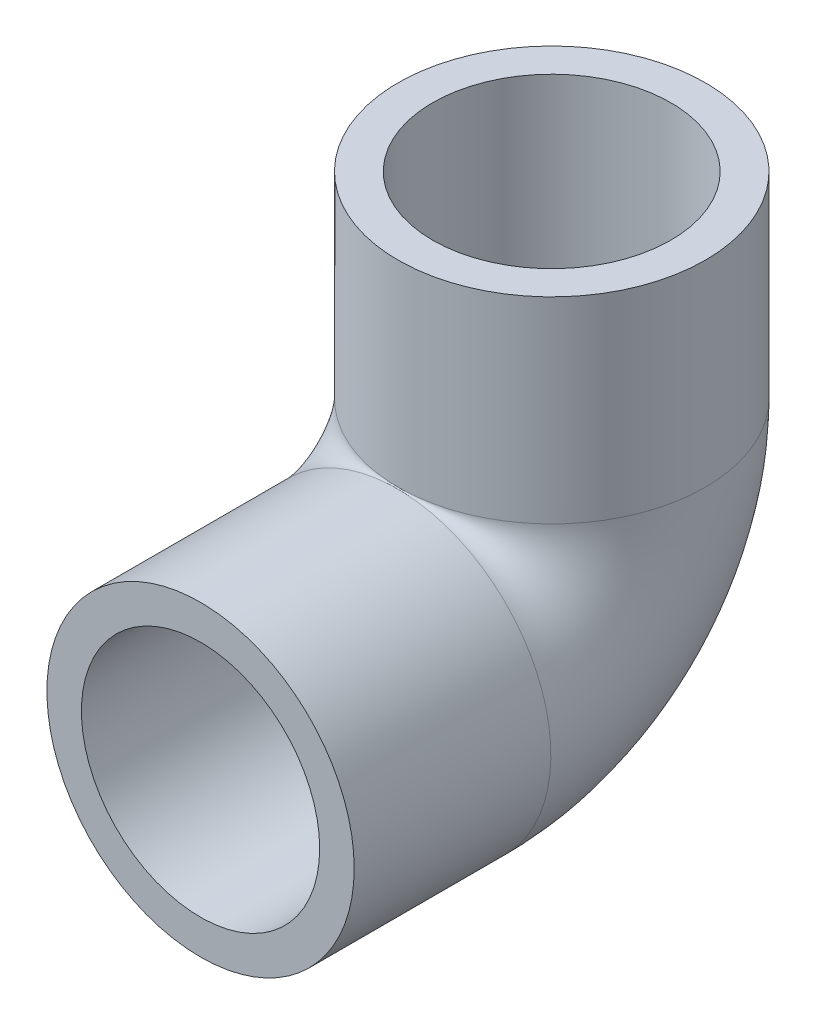
from build123d import *

# Parameters (mm, degrees)
SKETCH1_R          = 13.890625
SKETCH1_R_2        = 8.89
SKETCH3_R          = 10.7696
CUT_EXTRUDE1_DEPTH = 19.05
SKETCH4_R          = 10.7696
CUT_EXTRUDE2_DEPTH = 19.05


with BuildPart() as part:
    # Sweep1: sweep along a path in Sketch2
    with BuildLine(Plane(origin=(0, 0, 0), x_dir=(0, 0, -1), z_dir=(1, 0, 0))) as sweep1_path:
        Line((0, 0), (17.78, 0))
        ThreePointArc((17.78, 0), (27.658281733, 4.091718267), (31.75, 13.97))
        Line((31.75, 13.97), (31.75, 31.75))
    # Sketch1 → Sweep1 (sweep)
    with BuildSketch(Plane.XY):
        Circle(SKETCH1_R)
        Circle(SKETCH1_R_2, mode=Mode.SUBTRACT)
    sweep(path=sweep1_path.line)

    # Sketch3 → Cut-Extrude1 (cut)
    with BuildSketch(Plane.XY):
        Circle(SKETCH3_R)
    extrude(amount=-CUT_EXTRUDE1_DEPTH, mode=Mode.SUBTRACT)

    # Sketch4 → Cut-Extrude2 (cut)
    with BuildSketch(Plane(origin=(0, 31.75, 0), x_dir=(1, 0, 0), z_dir=(0, 1, 0))):
        with Locations(Location((0, 31.75, 0), (0, 0, 270))):
            Circle(SKETCH4_R)
    extrude(amount=-CUT_EXTRUDE2_DEPTH, mode=Mode.SUBTRACT)


solid = part.part
